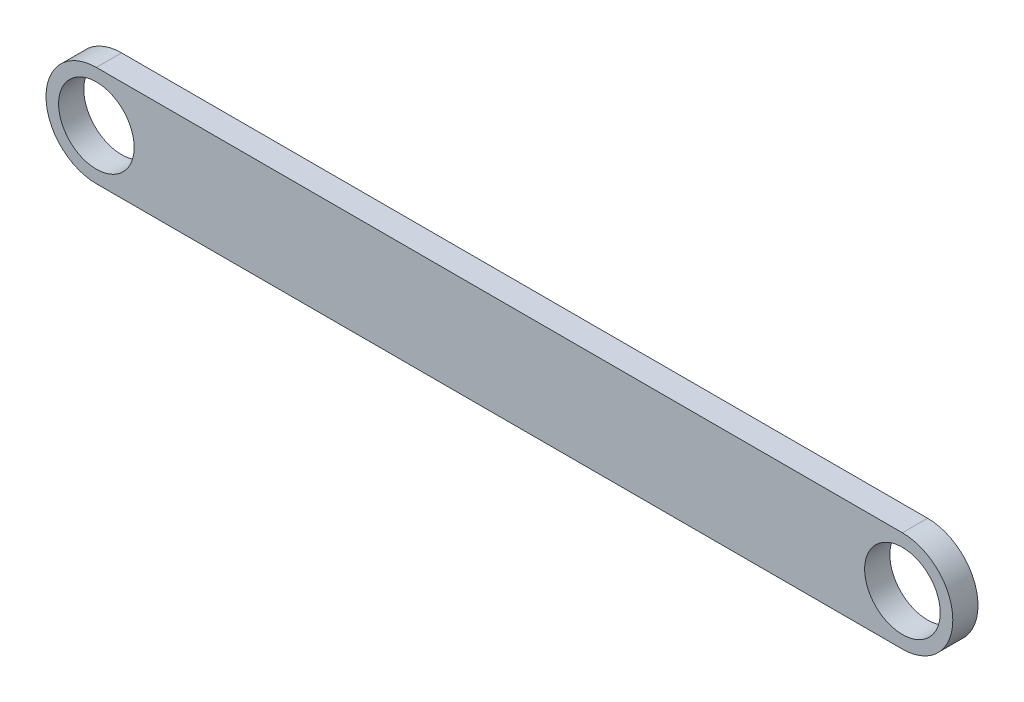
from build123d import *

# Parameters (mm, degrees)
SKETCH_1_R      = 15
EXTRUDE_1_DEPTH = 10


with BuildPart() as part:
    # Эскиз1 → Бобышка-Вытянуть1 (new body)
    with BuildSketch(Plane.XY):
        with BuildLine():
            Line((0, 20), (320, 20))
            ThreePointArc((320, 20), (340, 0), (320, -20))
            Line((320, -20), (0, -20))
            ThreePointArc((0, -20), (-20, 0), (0, 20))
        make_face()
        Circle(SKETCH_1_R, mode=Mode.SUBTRACT)
        with Locations((320, 0)):
            Circle(SKETCH_1_R, mode=Mode.SUBTRACT)
    extrude(amount=EXTRUDE_1_DEPTH)


solid = part.part
